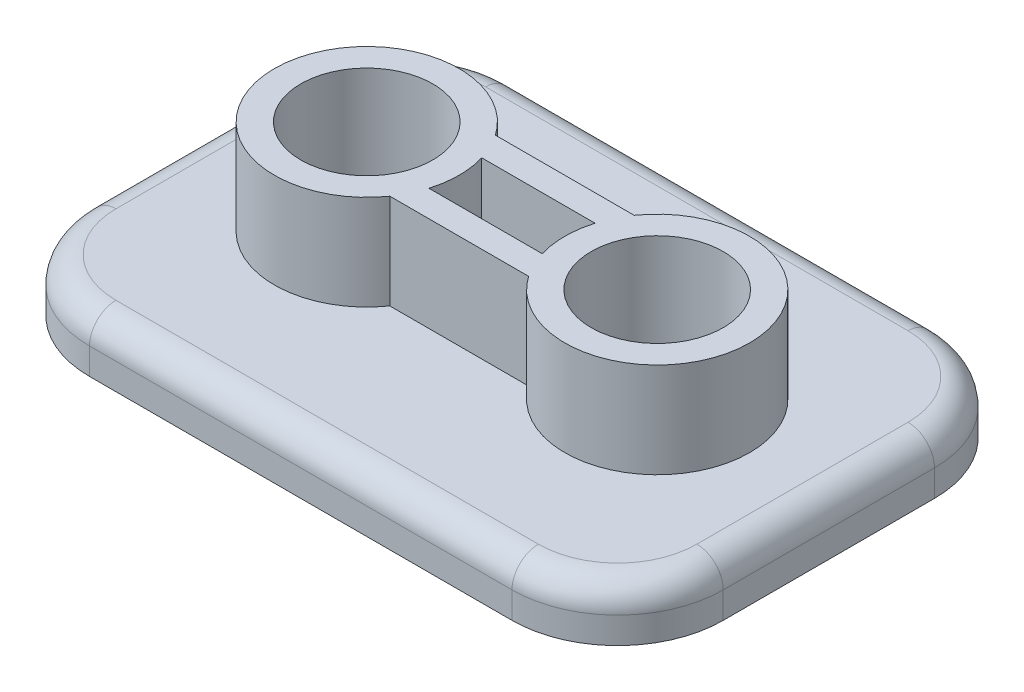
from build123d import *

# Parameters (mm, degrees)
SKETCH1_W           = 120
SKETCH1_H           = 80
BOSS_EXTRUDE1_DEPTH = 10
SKETCH2_R           = 17.5
SKETCH2_R_2         = 12.5
BOSS_EXTRUDE2_DEPTH = 18
FILLET1_R           = 20
FILLET2_R           = 5


with BuildPart() as part:
    # Sketch1 → Boss-Extrude1 (new body)
    with BuildSketch(Plane(origin=(0, 0, 0), x_dir=(1, 0, 0), z_dir=(0, 1, 0))):
        with Locations((60, 40)):
            Rectangle(SKETCH1_W, SKETCH1_H)
    extrude(amount=BOSS_EXTRUDE1_DEPTH)

    # Sketch2 → Boss-Extrude2 (add)
    # profile 1 of 4: a face of its own
    with BuildSketch(Plane(origin=(0, 10, 0), x_dir=(1, 0, 0), z_dir=(0, 1, 0))):
        with BuildLine():
            Line((49.270509831, 45), (70.729490169, 45))
            ThreePointArc((70.729490169, 45), (71.734561363, 47.596113781), (73.138593384, 50))
            Line((73.138593384, 50), (46.861406616, 50))
            ThreePointArc((46.861406616, 50), (48.265438637, 47.596113781), (49.270509831, 45))
        make_face()
    # profile 2 of 4: a face of its own
    with BuildSketch(Plane(origin=(0, 10, 0), x_dir=(1, 0, 0), z_dir=(0, 1, 0))):
        with Locations((32.5, 40)):
            Circle(SKETCH2_R)
        with Locations(Location((32.5, 40, 0), (0, 0, 270))):
            Circle(SKETCH2_R_2, mode=Mode.SUBTRACT)
    # profile 3 of 4: a face of its own
    with BuildSketch(Plane(origin=(0, 10, 0), x_dir=(1, 0, 0), z_dir=(0, 1, 0))):
        with BuildLine():
            ThreePointArc((73.138593384, 30), (71.734561363, 32.403886219), (70.729490169, 35))
            Line((70.729490169, 35), (49.270509831, 35))
            ThreePointArc((49.270509831, 35), (48.265438637, 32.403886219), (46.861406616, 30))
            Line((46.861406616, 30), (73.138593384, 30))
        make_face()
    # profile 4 of 4: a face of its own
    with BuildSketch(Plane(origin=(0, 10, 0), x_dir=(1, 0, 0), z_dir=(0, 1, 0))):
        with Locations((87.5, 40)):
            Circle(SKETCH2_R)
        with Locations(Location((87.5, 40, 0), (0, 0, 270))):
            Circle(SKETCH2_R_2, mode=Mode.SUBTRACT)
    extrude(amount=BOSS_EXTRUDE2_DEPTH)

    # Fillet1
    fillet1_edges = [part.edges().sort_by_distance(p)[0] for p in [
        (0, 5, -80),
        (120, 5, -80),
        (120, 5, 0),
        (0, 5, 0),
    ]]
    fillet(fillet1_edges, radius=FILLET1_R)

    # Fillet2
    fillet2_edges = [part.edges().sort_by_distance(p)[0] for p in [
        (0, 10, -40),
        (60, 10, -80),
        (60, 10, 0),
        (120, 10, -40),
        (5.857864376, 10, -5.857864376),
        (114.142135624, 10, -5.857864376),
        (114.142135624, 10, -74.142135624),
        (5.857864376, 10, -74.142135624),
    ]]
    fillet(fillet2_edges, radius=FILLET2_R)


solid = part.part
